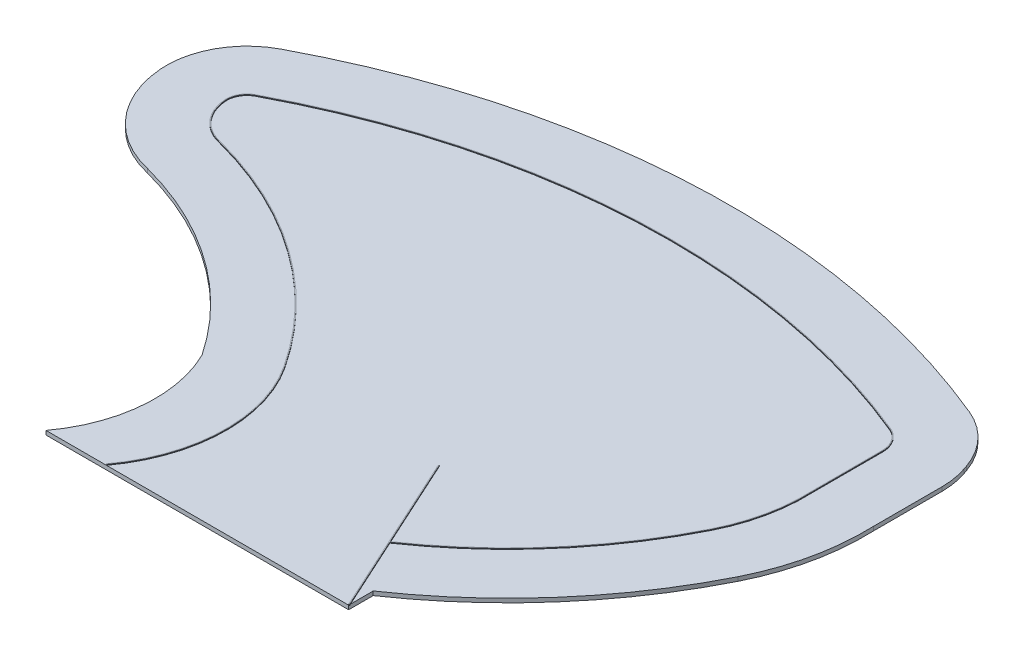
from build123d import *

# Parameters (mm, degrees)
BOSS_EXTRUDE1_DEPTH = 1
EXTRUDE_THIN1_START = 1
EXTRUDE_THIN1_DEPTH = 0.2


with BuildPart() as part:
    # Sketch3 → Boss-Extrude1 (new body)
    with BuildSketch(Plane(origin=(0, 0, 0), x_dir=(1, 0, 0), z_dir=(0, 1, 0))):
        with BuildLine():
            Line((143.614236161, 12.778644367), (143.614236161, 6.690833444))
            Line((143.614236161, 6.690833444), (83.614236161, 6.690833444))
            Line((83.614236161, 6.690833444), (68.614236161, 6.690833444))
            ThreePointArc((68.614236161, 6.690833444), (75.180479735, 23.997298156), (71.779240838, 42.192375773))
            ThreePointArc((71.779240838, 42.192375773), (51.379079295, 63.12072091), (24.905577059, 75.502800726))
            ThreePointArc((24.905577059, 75.502800726), (11.315687886, 83.748123559), (5.247844857, 98.440016471))
            ThreePointArc((5.247844857, 98.440016471), (7.693142423, 109.618807389), (15.866887418, 117.62722417))
            ThreePointArc((15.866887418, 117.62722417), (96.637810578, 139.573762678), (179.070811064, 125.068832083))
            ThreePointArc((179.070811064, 125.068832083), (185.95529686, 120.311391566), (190.290589438, 113.153555076))
            Line((190.290589438, 113.153555076), (190.62158299, 112.199107439))
            ThreePointArc((190.62158299, 112.199107439), (191.44765289, 108.968802746), (191.725584387, 105.646151098))
            Line((191.725584387, 105.646151098), (191.725584387, 88.676044486))
            ThreePointArc((191.725584387, 88.676044486), (190.474138078, 74.473395816), (185.740302271, 61.024524277))
            ThreePointArc((185.740302271, 61.024524277), (167.758196388, 34.211461518), (143.614236161, 12.778644367))
        make_face()
    extrude(amount=BOSS_EXTRUDE1_DEPTH)

    # Sketch6 → Extrude-Thin1 (add)
    with BuildSketch(Plane(origin=(0, 0, 0), x_dir=(1, 0, 0), z_dir=(0, 1, 0)).offset(EXTRUDE_THIN1_START)):
        with BuildLine():
            ThreePointArc((135.157565874, 25.167539704), (156.459213519, 44.077209645), (172.324402154, 67.73374361))
            ThreePointArc((172.324402154, 67.73374361), (175.840861474, 77.773394532), (176.725584387, 88.374212526))
            Line((176.725584387, 88.374212526), (176.725584387, 105.646151098))
            ThreePointArc((176.725584387, 105.646151098), (175.822683582, 108.923695738), (173.313645893, 111.217657072))
            ThreePointArc((173.313645893, 111.217657072), (97.321055557, 124.589331548), (22.860686061, 104.357454747))
            ThreePointArc((22.860686061, 104.357454747), (20.817249813, 102.355350552), (20.205925421, 99.560652822))
            ThreePointArc((20.205925421, 99.560652822), (22.75737939, 93.448802044), (28.458504402, 90.078073505))
            ThreePointArc((28.458504402, 90.078073505), (60.346877221, 75.148921347), (84.753788625, 49.770769703))
            ThreePointArc((84.753788625, 49.770769703), (90.951279239, 28.051793518), (83.614236161, 6.690833444))
            Line((83.614236161, 6.690833444), (83.45325287, 6.809511075))
            ThreePointArc((83.45325287, 6.809511075), (90.751349173, 28.057082078), (84.586756318, 49.660768756))
            ThreePointArc((84.586756318, 49.660768756), (60.232106569, 74.985116949), (28.412138365, 89.883479249))
            ThreePointArc((28.412138365, 89.883479249), (22.605157011, 93.319061801), (20.006484347, 99.545711004))
            ThreePointArc((20.006484347, 99.545711004), (20.642261714, 102.452196643), (22.767435413, 104.534385006))
            ThreePointArc((22.767435413, 104.534385006), (97.315220897, 124.789273275), (173.396463183, 111.39982251))
            ThreePointArc((173.396463183, 111.39982251), (175.99119074, 109.031493114), (176.925584387, 105.644975177))
            Line((176.925584387, 105.644975177), (176.925584387, 88.378563485))
            ThreePointArc((176.925584387, 88.378563485), (176.036009323, 77.729553344), (172.503280822, 67.644287353))
            ThreePointArc((172.503280822, 67.644287353), (156.609866623, 43.945666337), (135.270321477, 25.002354432))
            Line((135.270321477, 25.002354432), (135.157565874, 25.167539704))
        make_face()
        Polygon((143.614236161, 6.690833444), (124.886408885, 47.608659456), (125.068265889, 47.691894244), (143.796093165, 6.774068232), align=None)
    extrude(amount=EXTRUDE_THIN1_DEPTH)


solid = part.part
